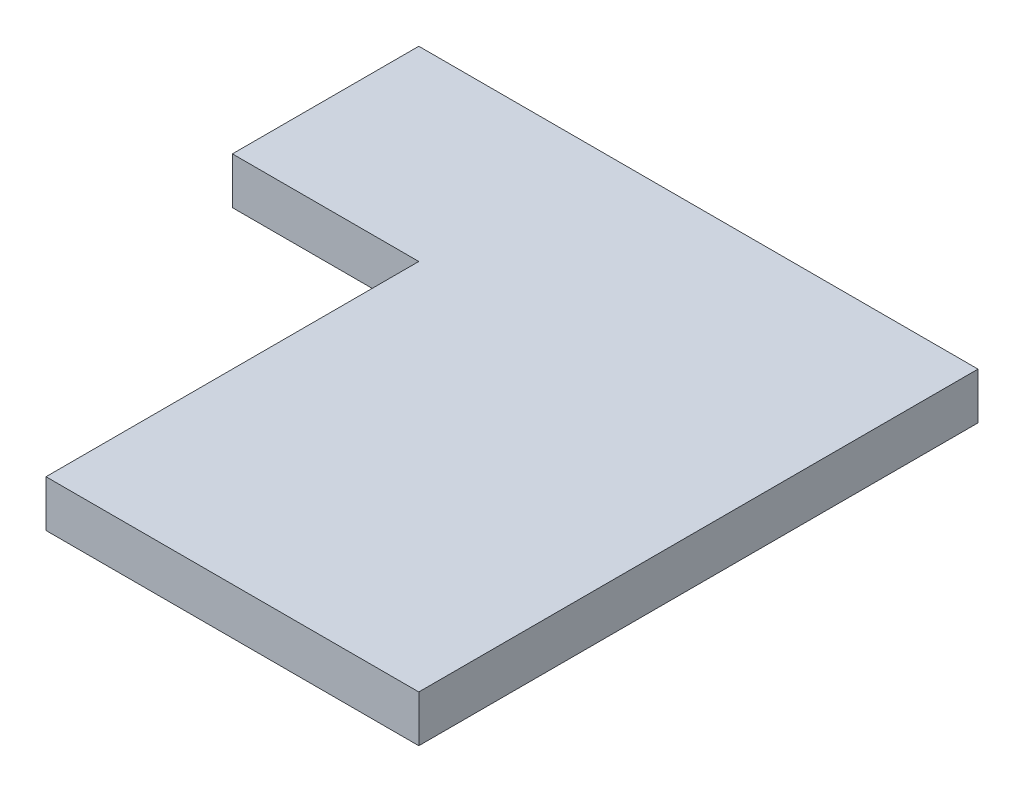
from build123d import *

# Parameters (mm, degrees)
SKETCH_1_W          = 2400
SKETCH_1_H          = 2400
EXTRUDE_1_DEPTH     = 200
SKETCH_2_W          = 800
SKETCH_2_H          = 1600
CUT_EXTRUDE_1_DEPTH = 200


with BuildPart() as part:
    # 草图1 → 凸台-拉伸1 (new body)
    with BuildSketch(Plane(origin=(0, 0, 0), x_dir=(1, 0, 0), z_dir=(0, 1, 0))):
        Rectangle(SKETCH_1_W, SKETCH_1_H)
    extrude(amount=EXTRUDE_1_DEPTH)

    # 草图2 → 切除-拉伸1 (cut)
    with BuildSketch(Plane(origin=(0, 0, 0), x_dir=(1, 0, 0), z_dir=(0, 1, 0))):
        with Locations((-800, -400)):
            Rectangle(SKETCH_2_W, SKETCH_2_H)
    extrude(amount=CUT_EXTRUDE_1_DEPTH, mode=Mode.SUBTRACT)


solid = part.part
